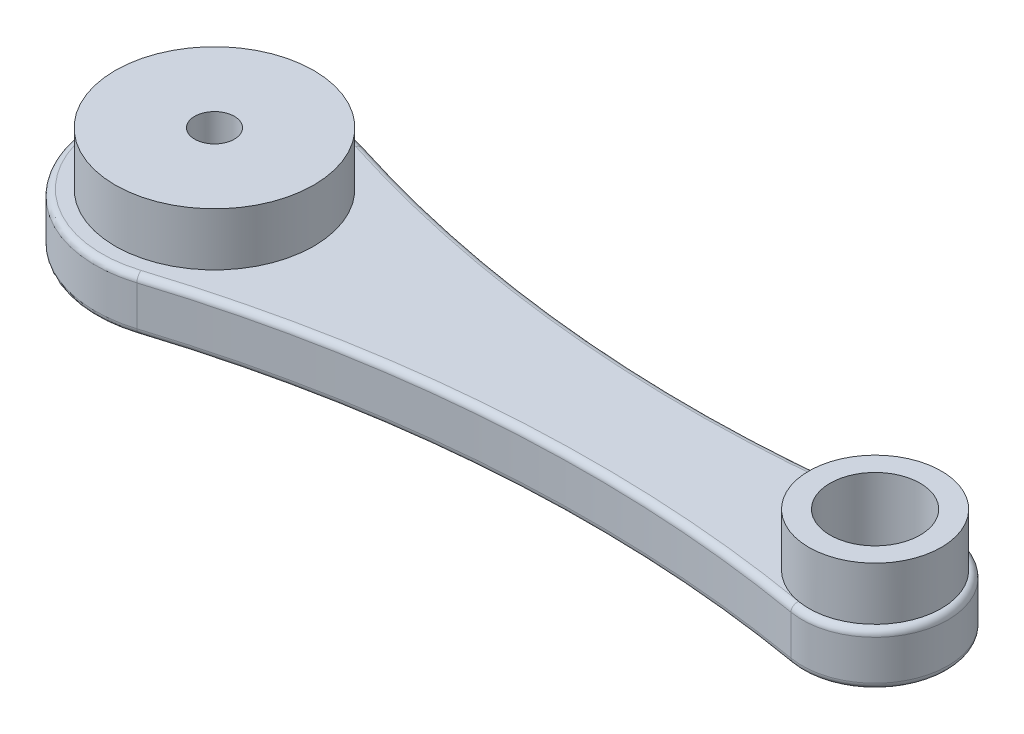
from build123d import *

# Parameters (mm, degrees)
SKETCH_1_R      = 1.5
SKETCH_1_R_2    = 3.4
EXTRUDE_1_DEPTH = 4
FILLET_1_R      = 0.5
SKETCH_2_R      = 7.5
SKETCH_2_R_2    = 1.5
SKETCH_2_R_3    = 5
SKETCH_2_R_4    = 3.4
EXTRUDE_2_DEPTH = 4


with BuildPart() as part:
    # 草图1 → 凸台-拉伸1 (new body)
    with BuildSketch(Plane(origin=(0, 0, 0), x_dir=(1, 0, 0), z_dir=(0, 1, 0))):
        with BuildLine():
            ThreePointArc((2.718196527, 8.579709065), (-9, 0), (2.718196527, -8.579709065))
            ThreePointArc((2.718196527, -8.579709065), (25.653399298, -4.228021884), (48.967323861, -5.420342722))
            ThreePointArc((48.967323861, -5.420342722), (55.4, 0), (48.967323861, 5.420342722))
            ThreePointArc((48.967323861, 5.420342722), (25.653399298, 4.228021884), (2.718196527, 8.579709065))
        make_face()
        with Locations(Location((0, 0, 0), (0, 0, 270))):
            Circle(SKETCH_1_R, mode=Mode.SUBTRACT)
        with Locations(Location((49.9, 0, 0), (0, 0, 270))):
            Circle(SKETCH_1_R_2, mode=Mode.SUBTRACT)
    extrude(amount=EXTRUDE_1_DEPTH)

    # 圆角1
    fillet_1_edges = [part.edges().sort_by_distance(p)[0] for p in [
        (25.653399298, 4, 4.228021884),
        (55.4, 4, 0),
        (25.653399298, 4, -4.228021884),
        (55.4, 0, 0),
        (25.653399298, 0, 4.228021884),
        (-9, 0, 0),
        (25.653399298, 0, -4.228021884),
        (-9, 4, 0),
    ]]
    fillet(fillet_1_edges, radius=FILLET_1_R)

    # 草图2 → 凸台-拉伸2 (add)
    # profile 1 of 2: a face of its own
    with BuildSketch(Plane(origin=(0, 4, 0), x_dir=(1, 0, 0), z_dir=(0, 1, 0))):
        with Locations(Location((0, 0, 0), (0, 0, 90))):
            Circle(SKETCH_2_R)
        with Locations(Location((0, 0, 0), (0, 0, 90))):
            Circle(SKETCH_2_R_2, mode=Mode.SUBTRACT)
    # profile 2 of 2: a face of its own
    with BuildSketch(Plane(origin=(0, 4, 0), x_dir=(1, 0, 0), z_dir=(0, 1, 0))):
        with Locations(Location((49.9, 0, 0), (0, 0, 99.763253754))):
            Circle(SKETCH_2_R_3)
        with Locations(Location((49.9, 0, 0), (0, 0, 90))):
            Circle(SKETCH_2_R_4, mode=Mode.SUBTRACT)
    extrude(amount=EXTRUDE_2_DEPTH)


solid = part.part
